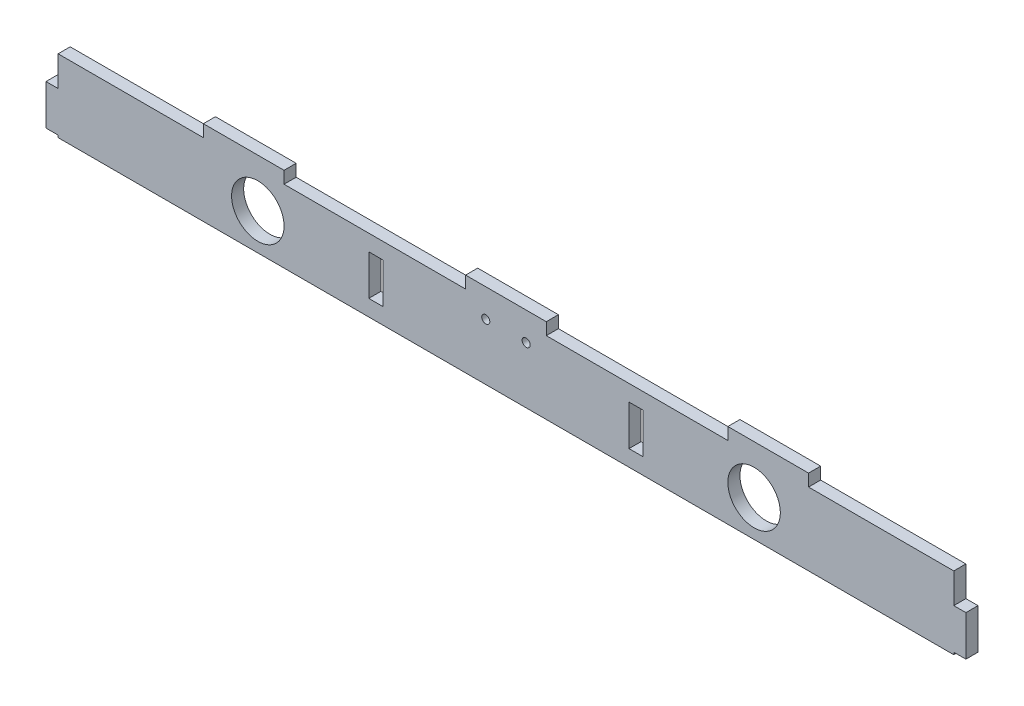
from build123d import *

# Parameters (mm, degrees)
CROQUIS1_W              = 222
CROQUIS1_H              = 18
CROQUIS1_R              = 1
CROQUIS1_R_2            = 6.5
CROQUIS1_W_2            = 3.5
CROQUIS1_H_2            = 10
SALIENTE_EXTRUIR1_DEPTH = 3
CROQUIS2_W              = 20
CROQUIS2_H              = 3
SALIENTE_EXTRUIR2_DEPTH = 3
CROQUIS3_W              = 3
CROQUIS3_H              = 10
SALIENTE_EXTRUIR3_DEPTH = 3


with BuildPart() as part:
    # Croquis1 → Saliente-Extruir1 (new body)
    with BuildSketch(Plane.XY):
        Rectangle(CROQUIS1_W, CROQUIS1_H)
        with Locations((-5, 5)):
            Circle(CROQUIS1_R, mode=Mode.SUBTRACT)
        with Locations(Location((5, 5, 0), (0, 0, 180))):
            Circle(CROQUIS1_R, mode=Mode.SUBTRACT)
        with Locations((-61.5, 0)):
            Circle(CROQUIS1_R_2, mode=Mode.SUBTRACT)
        with Locations(Location((61.5, 0, 0), (0, 0, 180))):
            Circle(CROQUIS1_R_2, mode=Mode.SUBTRACT)
        with Locations((32.25, 0)):
            Rectangle(CROQUIS1_W_2, CROQUIS1_H_2, mode=Mode.SUBTRACT)
        with Locations((-32.25, 0)):
            Rectangle(CROQUIS1_W_2, CROQUIS1_H_2, mode=Mode.SUBTRACT)
    extrude(amount=SALIENTE_EXTRUIR1_DEPTH)

    # Croquis2 → Saliente-Extruir2 (add)
    with BuildSketch(Plane(origin=(0, 9, 0), x_dir=(1, 0, 0), z_dir=(0, 1, 0))):
        with Locations((-65, -1.5)):
            Rectangle(CROQUIS2_W, CROQUIS2_H)
        with Locations((0, -1.5)):
            Rectangle(CROQUIS2_W, CROQUIS2_H)
        with Locations((65, -1.5)):
            Rectangle(CROQUIS2_W, CROQUIS2_H)
    extrude(amount=SALIENTE_EXTRUIR2_DEPTH)

    # Croquis3 → Saliente-Extruir3 (add)
    with BuildSketch(Plane(origin=(111, 0, 0), x_dir=(0, 0, -1), z_dir=(1, 0, 0))):
        with Locations((-1.5, -3.45)):
            Rectangle(CROQUIS3_W, CROQUIS3_H)
    saliente_extruir3 = extrude(amount=SALIENTE_EXTRUIR3_DEPTH)

    # Simetría1: Saliente-Extruir3 across plane
    add(saliente_extruir3.mirror(Plane(origin=(0, 0, 0), x_dir=(0, 0, 1), z_dir=(1, 0, 0))))


solid = part.part
